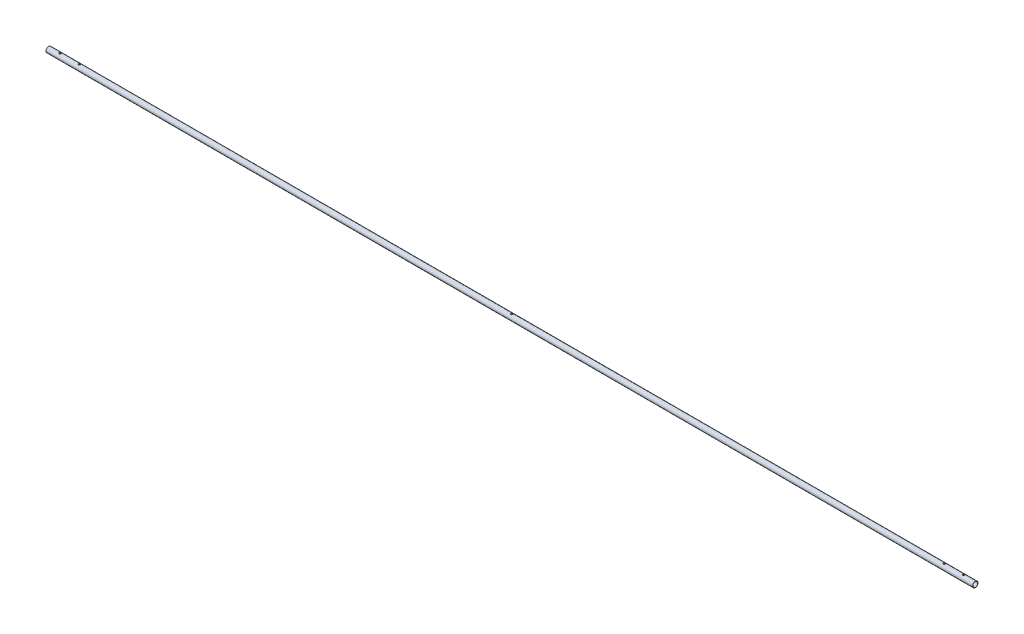
from build123d import *

# Parameters (mm, degrees)
SKETCH1_R               = 8.9662
SKETCH1_R_2             = 7.8994
BOSS_EXTRUDE1_DEPTH     = 3048
CUT_EXTRUDE2_DEPTH      = 3049.026375458
CUT_EXTRUDE2_DEPTH_BACK = 3049.026375458
SKETCH3_R               = 3.175
CUT_EXTRUDE5_DEPTH      = 3049.026375558
CUT_EXTRUDE5_DEPTH_BACK = 3049.026375558
SKETCH2_R               = 3.175


with BuildPart() as part:
    # Sketch1 → Boss-Extrude1 (new body)
    with BuildSketch(Plane(origin=(0, 0, 0), x_dir=(0, 0, -1), z_dir=(1, 0, 0))):
        Circle(SKETCH1_R)
        Circle(SKETCH1_R_2, mode=Mode.SUBTRACT)
    extrude(amount=BOSS_EXTRUDE1_DEPTH)

    # Sketch3 → Cut-Extrude2 (cut, two sides: drawn at the far end of the back side and taken through both)
    with BuildSketch(Plane(origin=(0, 0, 0), x_dir=(1, 0, 0), z_dir=(0, 1, 0)).offset(-CUT_EXTRUDE2_DEPTH_BACK)):
        with Locations(Location((1524, 0, 0), (0, 0, 270))):
            Circle(SKETCH3_R)
    extrude(amount=CUT_EXTRUDE2_DEPTH + CUT_EXTRUDE2_DEPTH_BACK, mode=Mode.SUBTRACT)

    # Sketch2 → Cut-Extrude5 (cut, two sides: drawn at the far end of the back side and taken through both)
    with BuildSketch(Plane(origin=(0, 0, 0), x_dir=(1, 0, 0), z_dir=(0, 1, 0)).offset(-CUT_EXTRUDE5_DEPTH_BACK)):
        with Locations(Location((38.1, 0, 0), (0, 0, 270))):
            Circle(SKETCH2_R)
        with Locations(Location((3009.9, 0, 0), (0, 0, 270))):
            Circle(SKETCH2_R)
        with Locations(Location((101.6, 0, 0), (0, 0, 270))):
            Circle(SKETCH2_R)
        with Locations(Location((2946.4, 0, 0), (0, 0, 270))):
            Circle(SKETCH2_R)
    extrude(amount=CUT_EXTRUDE5_DEPTH + CUT_EXTRUDE5_DEPTH_BACK, mode=Mode.SUBTRACT)


solid = part.part
